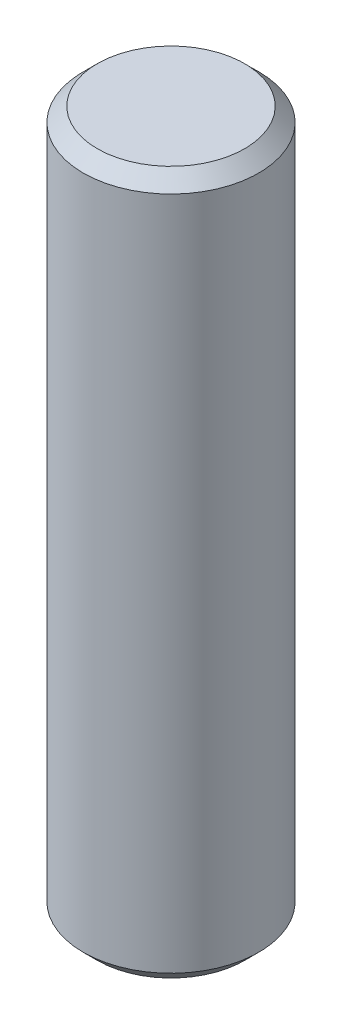
from build123d import *


with BuildPart() as part:
    # Sketch1 → Revolve1 (revolve)
    with BuildSketch(Plane(origin=(0, 0, 0), x_dir=(-1, 0, 0), z_dir=(0, 0, -1)), mode=Mode.PRIVATE) as revolve1_sk:
        Polygon((-2.66319, 0), (0, 0), (0, 25.4), (-2.66319, 25.4), (-3.17119, 24.892), (-3.17119, 0.508), align=None)
    revolve(revolve1_sk.sketch.rotate(Axis((0, 0, 0), (0, 1, 0)), 270), axis=Axis((0, 0, 0), (0, 1, 0)))


solid = part.part
